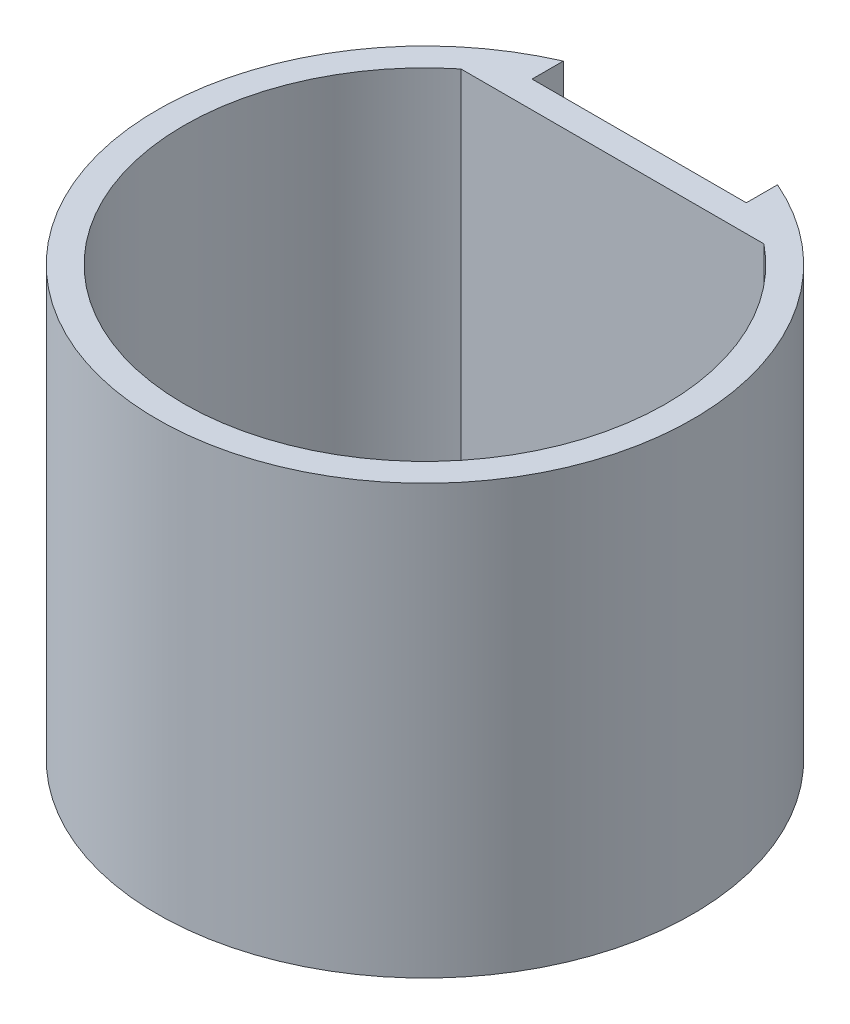
from build123d import *

# Parameters (mm, degrees)
BOSS_EXTRUDE1_DEPTH = 160
CUT_EXTRUDE1_DEPTH  = 150


with BuildPart() as part:
    # Sketch1 → Boss-Extrude1 (new body)
    with BuildSketch(Plane(origin=(0, 0, 0), x_dir=(1, 0, 0), z_dir=(0, 1, 0))):
        with BuildLine():
            Line((-40, 91.651513899), (-40, 80))
            Line((-40, 80), (40, 80))
            Line((40, 80), (40, 91.651513899))
            ThreePointArc((40, 91.651513899), (0, -100), (-40, 91.651513899))
        make_face()
    extrude(amount=-BOSS_EXTRUDE1_DEPTH)

    # Sketch2 → Cut-Extrude1 (cut)
    with BuildSketch(Plane(origin=(0, 0, 0), x_dir=(1, 0, 0), z_dir=(0, 1, 0))):
        with BuildLine():
            Line((50, 70), (-50, 70))
            Line((-50, 70), (-56.568542495, 70))
            ThreePointArc((-56.568542495, 70), (0, -90), (56.568542495, 70))
            Line((56.568542495, 70), (50, 70))
        make_face()
    extrude(amount=-CUT_EXTRUDE1_DEPTH, mode=Mode.SUBTRACT)


solid = part.part
